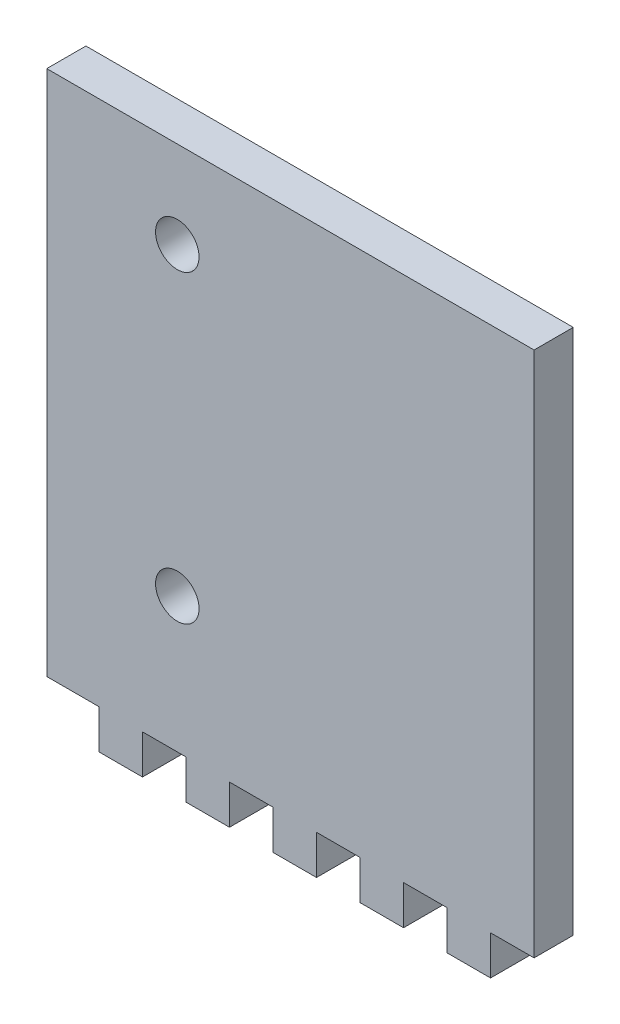
from build123d import *

# Parameters (mm, degrees)
SKETCH1_R           = 2.5
SKETCH1_W           = 5
SKETCH1_H           = 4.5
BOSS_EXTRUDE1_DEPTH = 4.5


with BuildPart() as part:
    # Sketch1 → Boss-Extrude1 (new body)
    # profile 1 of 5: a face of its own
    with BuildSketch(Plane.XY):
        Polygon((-111.932160423, -1.614828107), (-111.932160423, -6.114828107), (-106.932160423, -6.114828107), (-106.932160423, -1.614828107), (-101.932160423, -1.614828107), (-96.932160423, -1.614828107), (-91.932160423, -1.614828107), (-86.932160423, -1.614828107), (-81.932160423, -1.614828107), (-76.932160423, -1.614828107), (-71.932160423, -1.614828107), (-66.932160423, -1.614828107), (-61.932160423, -1.614828107), (-61.932160423, 58.885171893), (-117.932160423, 58.885171893), (-117.932160423, -1.614828107), align=None)
        with Locations((-102.932160423, 13.885171893)):
            Circle(SKETCH1_R, mode=Mode.SUBTRACT)
        with Locations((-102.932160423, 48.885171893)):
            Circle(SKETCH1_R, mode=Mode.SUBTRACT)
    # profile 2 of 5: a face of its own
    with BuildSketch(Plane.XY):
        with Locations((-99.432160423, -3.864828107)):
            Rectangle(SKETCH1_W, SKETCH1_H)
    # profile 3 of 5: a face of its own
    with BuildSketch(Plane.XY):
        with Locations((-69.432160423, -3.864828107)):
            Rectangle(SKETCH1_W, SKETCH1_H)
    # profile 4 of 5: a face of its own
    with BuildSketch(Plane.XY):
        with Locations((-79.432160423, -3.864828107)):
            Rectangle(SKETCH1_W, SKETCH1_H)
    # profile 5 of 5: a face of its own
    with BuildSketch(Plane.XY):
        with Locations((-89.432160423, -3.864828107)):
            Rectangle(SKETCH1_W, SKETCH1_H)
    extrude(amount=BOSS_EXTRUDE1_DEPTH)


solid = part.part
